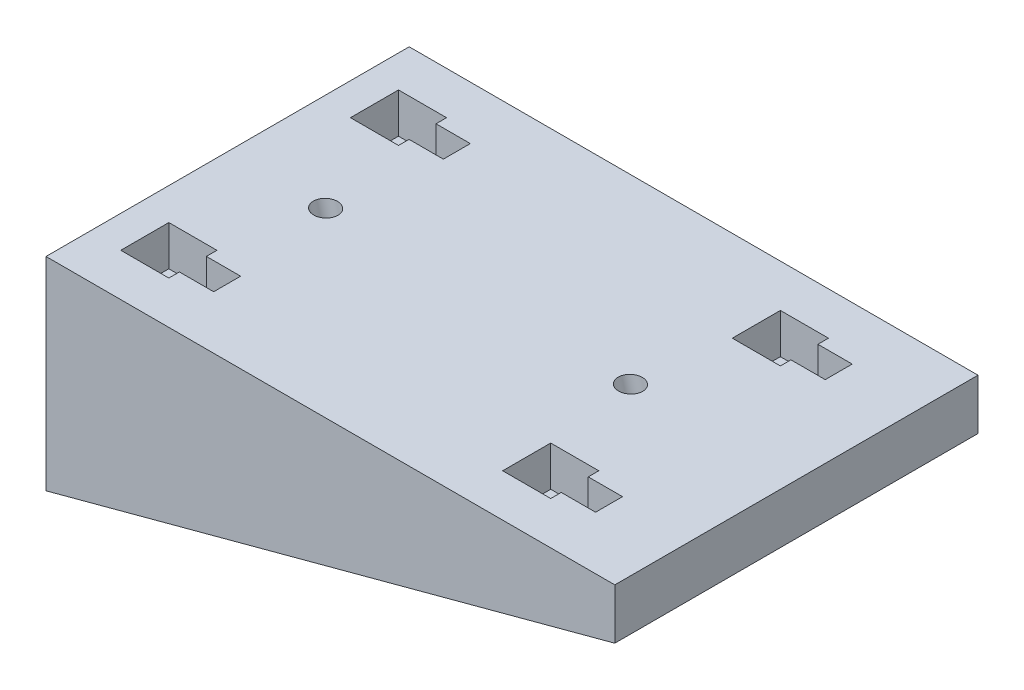
from build123d import *

# Parameters (mm, degrees)
BOSS_EXTRUDE1_DEPTH      = 22
BOSS_EXTRUDE1_DEPTH_BACK = 54
SKETCH1_W                = 213
SKETCH1_H                = 136
SKETCH2_W                = 18
SKETCH2_H                = 18
CUT_EXTRUDE1_DEPTH       = 15
CUT_EXTRUDE2_DEPTH       = 12.84
CUT_EXTRUDE3_DEPTH       = 12.84
CUT_EXTRUDE4_DEPTH       = 181.981352631
SKETCH9_R                = 1.905
CUT_EXTRUDE8_DEPTH       = 5
SKETCH11_R               = 4.445
CUT_EXTRUDE10_DEPTH      = 137.921009741


with BuildPart() as part:
    # Sketch1 → Boss-Extrude1 (new, two sides: drawn at the far end of the back side and taken through both)
    with BuildSketch(Plane(origin=(0, 0, 0), x_dir=(1, 0, 0), z_dir=(0, 1, 0)).offset(-BOSS_EXTRUDE1_DEPTH_BACK)):
        Rectangle(SKETCH1_W, SKETCH1_H)
    extrude(amount=BOSS_EXTRUDE1_DEPTH + BOSS_EXTRUDE1_DEPTH_BACK)

    # Sketch2 → Cut-Extrude1 (cut)
    with BuildSketch(Plane(origin=(0, 22, 0), x_dir=(1, 0, 0), z_dir=(0, 1, 0))):
        with Locations((-85.5, 43)):
            Rectangle(SKETCH2_W, SKETCH2_H)
        with Locations((-85.5, -43)):
            Rectangle(SKETCH2_W, SKETCH2_H)
        with Locations((57.5, 43)):
            Rectangle(SKETCH2_W, SKETCH2_H)
        with Locations((57.5, -43)):
            Rectangle(SKETCH2_W, SKETCH2_H)
    extrude(amount=-CUT_EXTRUDE1_DEPTH, mode=Mode.SUBTRACT)

    # Sketch4 → Cut-Extrude2 (cut)
    with BuildSketch(Plane.ZY.offset(76.5)):
        Polygon((34, 7), (52, 7), (52, 11), (48.05, 11), (48.05, 24.194829177), (37.95, 24.194829177), (37.95, 11), (34, 11), align=None)
        Polygon((-34, 7), (-52, 7), (-52, 11), (-48.05, 11), (-48.05, 24.194829177), (-37.95, 24.194829177), (-37.95, 11), (-34, 11), align=None)
    extrude(amount=-CUT_EXTRUDE2_DEPTH, mode=Mode.SUBTRACT)

    # Sketch5 → Cut-Extrude3 (cut)
    with BuildSketch(Plane.ZY.offset(-66.5)):
        Polygon((34, 7), (52, 7), (52, 11), (48.05, 11), (48.05, 24.194829177), (37.95, 24.194829177), (37.95, 11), (34, 11), align=None)
        Polygon((-34, 7), (-52, 7), (-52, 11), (-48.05, 11), (-48.05, 24.194829177), (-37.95, 24.194829177), (-37.95, 11), (-34, 11), align=None)
    extrude(amount=-CUT_EXTRUDE3_DEPTH, mode=Mode.SUBTRACT)

    # Sketch7 → Cut-Extrude4 (cut, through all)
    with BuildSketch(Plane(origin=(0, 0, -68), x_dir=(-1, 0, 0), z_dir=(0, 0, -1))):
        Polygon((106.5, -54), (-106.5, 3.073177988), (-106.5, -54), align=None)
    extrude(amount=-CUT_EXTRUDE4_DEPTH, mode=Mode.SUBTRACT)

    # Sketch9 → Cut-Extrude8 (cut)
    with BuildSketch(Plane(origin=(6.365852752, -23.757685902, 0), x_dir=(0.9659258262890681, 0.2588190451025214, 0), z_dir=(0.2588190451025214, -0.9659258262890681, 0))):
        with Locations((-61.719828935, 0)):
            Circle(SKETCH9_R)
        with Locations((48.538997492, 0)):
            Circle(SKETCH9_R)
    extrude(amount=-CUT_EXTRUDE8_DEPTH, mode=Mode.SUBTRACT)

    # Sketch11 → Cut-Extrude10 (cut, through all)
    with BuildSketch(Plane(origin=(5.071757526, -18.928056771, 0), x_dir=(0.9659258262890681, 0.25881904510252135, 0), z_dir=(0.25881904510252135, -0.9659258262890681, 0))):
        with Locations((-61.719828935, 0)):
            Circle(SKETCH11_R)
        with Locations((48.538997492, 0)):
            Circle(SKETCH11_R)
    extrude(amount=-CUT_EXTRUDE10_DEPTH, mode=Mode.SUBTRACT)


solid = part.part
